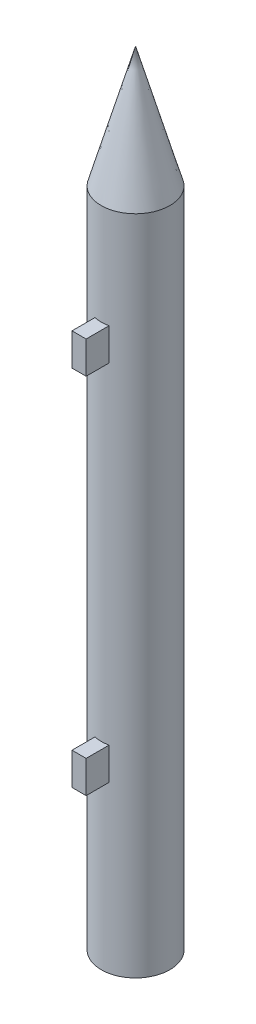
from build123d import *

# Parameters (mm, degrees)
SKETCH3_W           = 14
SKETCH3_H           = 8
BOSS_EXTRUDE2_DEPTH = 1.75


with BuildPart() as part:
    # Sketch2 → Revolve2 (revolve)
    with BuildSketch(Plane(origin=(0, 0, 0), x_dir=(0, 0, -1), z_dir=(1, 0, 0))):
        Polygon((34, 200), (42.5, 170), (42.5, 20), (42.5, 10), (42.5, 6), (34, 6), align=None)
    revolve(axis=Axis((0, 6, -34), (0, 1, 0)))

    # Sketch3 → Boss-Extrude2 (add, symmetric)
    with BuildSketch(Plane(origin=(0, 0, 0), x_dir=(0, 0, -1), z_dir=(1, 0, 0))):
        with Locations((27, 141)):
            Rectangle(SKETCH3_W, SKETCH3_H)
        with Locations((27, 51)):
            Rectangle(SKETCH3_W, SKETCH3_H)
    extrude(amount=BOSS_EXTRUDE2_DEPTH, both=True)


solid = part.part
